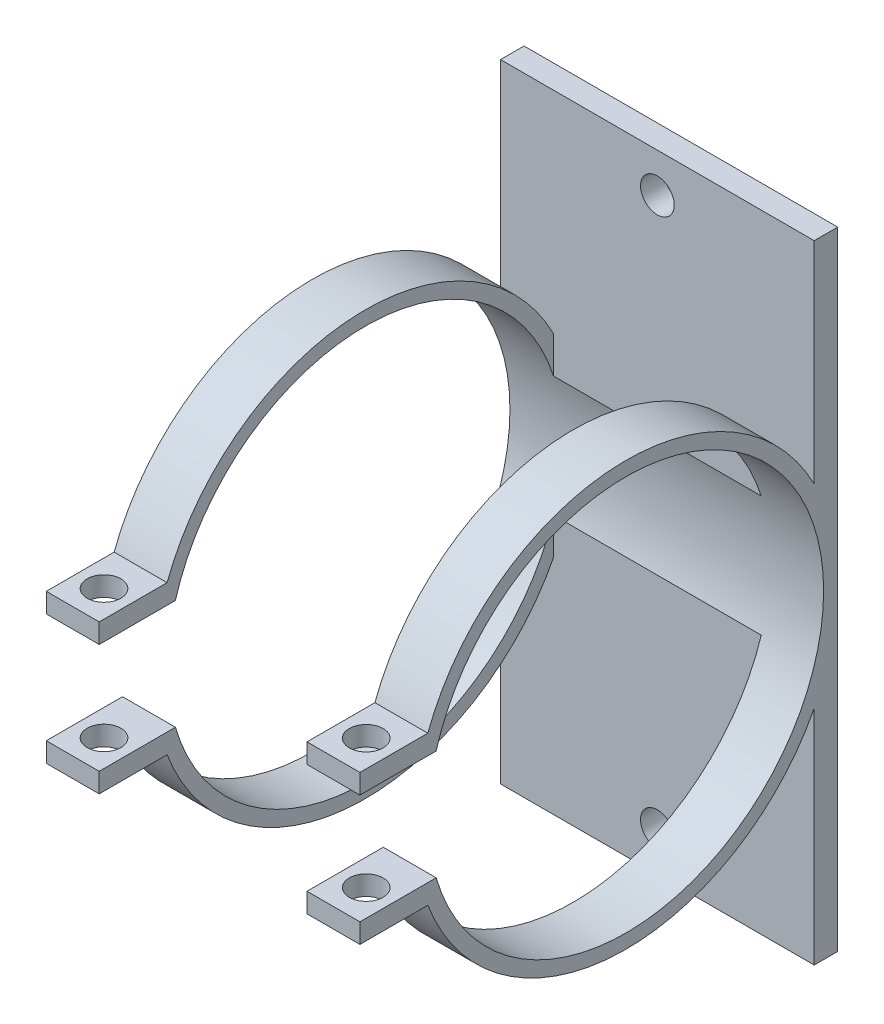
from build123d import *

# Parameters (mm, degrees)
SKETCH1_W           = 40
SKETCH1_H           = 80
SKETCH1_R           = 2.15
BOSS_EXTRUDE1_DEPTH = 3
BOSS_EXTRUDE2_DEPTH = 40
SKETCH3_R           = 25.2
CUT_EXTRUDE1_DEPTH  = 40
CUT_EXTRUDE2_REACH  = 110.225
SKETCH5_W           = 26.5
SKETCH5_H           = 54
SKETCH6_R           = 2.15
CUT_EXTRUDE3_DEPTH  = 89.527071115
SKETCH7_R           = 2.15
CUT_EXTRUDE4_DEPTH  = 89.527071115


with BuildPart() as part:
    # Sketch1 → Boss-Extrude1 (new body)
    with BuildSketch(Plane.XY):
        with Locations((20, 40)):
            Rectangle(SKETCH1_W, SKETCH1_H)
        with Locations((20, 75)):
            Circle(SKETCH1_R, mode=Mode.SUBTRACT)
        with Locations((20, 5)):
            Circle(SKETCH1_R, mode=Mode.SUBTRACT)
    extrude(amount=BOSS_EXTRUDE1_DEPTH)

    # Sketch2 → Boss-Extrude2 (add)
    with BuildSketch(Plane.ZY):
        with BuildLine():
            Line((51.208263052, 47.742845654), (60.931919228, 47.742845654))
            Line((60.931919228, 47.742845654), (60.931919228, 50.242845654))
            Line((60.931919228, 50.242845654), (52.273503912, 50.242845654))
            ThreePointArc((52.273503912, 50.242845654), (0, 40.742845654), (52.273503912, 31.242845654))
            Line((52.273503912, 31.242845654), (60.931919228, 31.242845654))
            Line((60.931919228, 31.242845654), (60.931919228, 33.742845654))
            Line((60.931919228, 33.742845654), (51.208263052, 33.742845654))
            ThreePointArc((51.208263052, 33.742845654), (1.8, 40.742845654), (51.208263052, 47.742845654))
        make_face()
    extrude(amount=-BOSS_EXTRUDE2_DEPTH)

    # Sketch3 → Cut-Extrude1 (cut)
    with BuildSketch(Plane.ZY):
        with Locations((27, 40.742845654)):
            Circle(SKETCH3_R)
    extrude(amount=-CUT_EXTRUDE1_DEPTH, mode=Mode.SUBTRACT)

    # Cut-Extrude2: up to this face of the body (flat: up to its plane)
    cut_extrude2_end = Plane(part.part.faces().sort_by_distance((20, 66.440507587, 3))[0])
    # Sketch5 → Cut-Extrude2 (cut, up to the picked face)
    with BuildSketch(Plane.XY.offset(60.931919228), mode=Mode.PRIVATE) as cut_extrude2_sk1:
        with Locations((20, 40.742845654)):
            Rectangle(SKETCH5_W, SKETCH5_H)
    cut_extrude2_tool1 = split(extrude(cut_extrude2_sk1.sketch, amount=-CUT_EXTRUDE2_REACH, mode=Mode.PRIVATE), bisect_by=cut_extrude2_end, keep=Keep.BOTH, mode=Mode.PRIVATE)
    add(cut_extrude2_tool1.solids().sort_by(Axis((20, 40.742846, 60.931919), (0, 0, -1)))[0], mode=Mode.SUBTRACT)

    # Sketch6 → Cut-Extrude3 (cut, through all)
    with BuildSketch(Plane(origin=(0, 50.242845654, 0), x_dir=(1, 0, 0), z_dir=(0, 1, 0))):
        with Locations(Location((3.375, -56.940793842, 0), (0, 0, 270))):
            Circle(SKETCH6_R)
        with Locations((21.625, -56.940793842)):
            Circle(SKETCH6_R)
    extrude(amount=-CUT_EXTRUDE3_DEPTH, mode=Mode.SUBTRACT)

    # Sketch7 → Cut-Extrude4 (cut, through all)
    with BuildSketch(Plane(origin=(0, 50.242845654, 0), x_dir=(1, 0, 0), z_dir=(0, 1, 0))):
        with Locations(Location((36.625, -56.75422316, 0), (0, 0, 270))):
            Circle(SKETCH7_R)
    extrude(amount=-CUT_EXTRUDE4_DEPTH, mode=Mode.SUBTRACT)


solid = part.part
